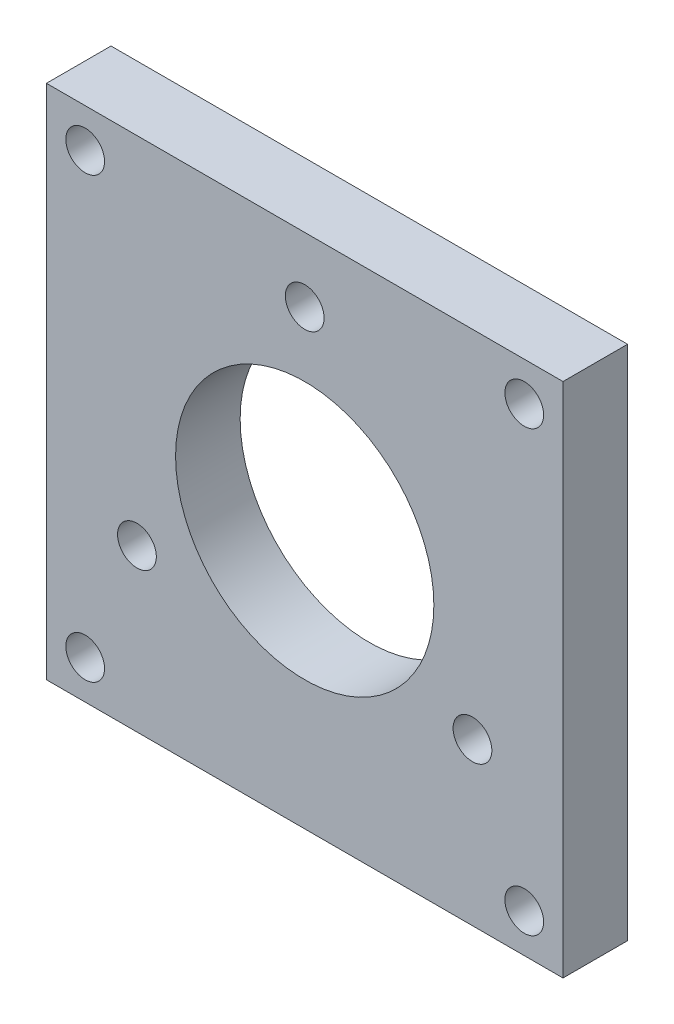
from build123d import *

# Parameters (mm, degrees)
SKETCH1_W           = 40
SKETCH1_H           = 40
BOSS_EXTRUDE1_DEPTH = 5
SKETCH2_R           = 10
CUT_EXTRUDE1_DEPTH  = 5
SKETCH3_R           = 1.5
CUT_EXTRUDE2_DEPTH  = 5
SKETCH4_R           = 1.5
CUT_EXTRUDE3_DEPTH  = 5


with BuildPart() as part:
    # Sketch1 → Boss-Extrude1 (new body)
    with BuildSketch(Plane.XY):
        Rectangle(SKETCH1_W, SKETCH1_H)
    extrude(amount=BOSS_EXTRUDE1_DEPTH)

    # Sketch2 → Cut-Extrude1 (cut)
    with BuildSketch(Plane(origin=(0, 0, 0), x_dir=(-1, 0, 0), z_dir=(0, 0, -1))):
        Circle(SKETCH2_R)
    extrude(amount=-CUT_EXTRUDE1_DEPTH, mode=Mode.SUBTRACT)

    # Sketch3 → Cut-Extrude2 (cut)
    with BuildSketch(Plane(origin=(0, 0, 0), x_dir=(-1, 0, 0), z_dir=(0, 0, -1))):
        with Locations((0, 15)):
            Circle(SKETCH3_R)
        with Locations((12.990381057, -7.5)):
            Circle(SKETCH3_R)
        with Locations((-12.990381057, -7.5)):
            Circle(SKETCH3_R)
    extrude(amount=-CUT_EXTRUDE2_DEPTH, mode=Mode.SUBTRACT)

    # Sketch4 → Cut-Extrude3 (cut)
    with BuildSketch(Plane(origin=(0, 0, 0), x_dir=(-1, 0, 0), z_dir=(0, 0, -1))):
        with Locations((-17, 17)):
            Circle(SKETCH4_R)
        with Locations(Location((17, 17, 0), (0, 0, 180))):
            Circle(SKETCH4_R)
        with Locations((17, -17)):
            Circle(SKETCH4_R)
        with Locations(Location((-17, -17, 0), (0, 0, 180))):
            Circle(SKETCH4_R)
    extrude(amount=-CUT_EXTRUDE3_DEPTH, mode=Mode.SUBTRACT)


solid = part.part
